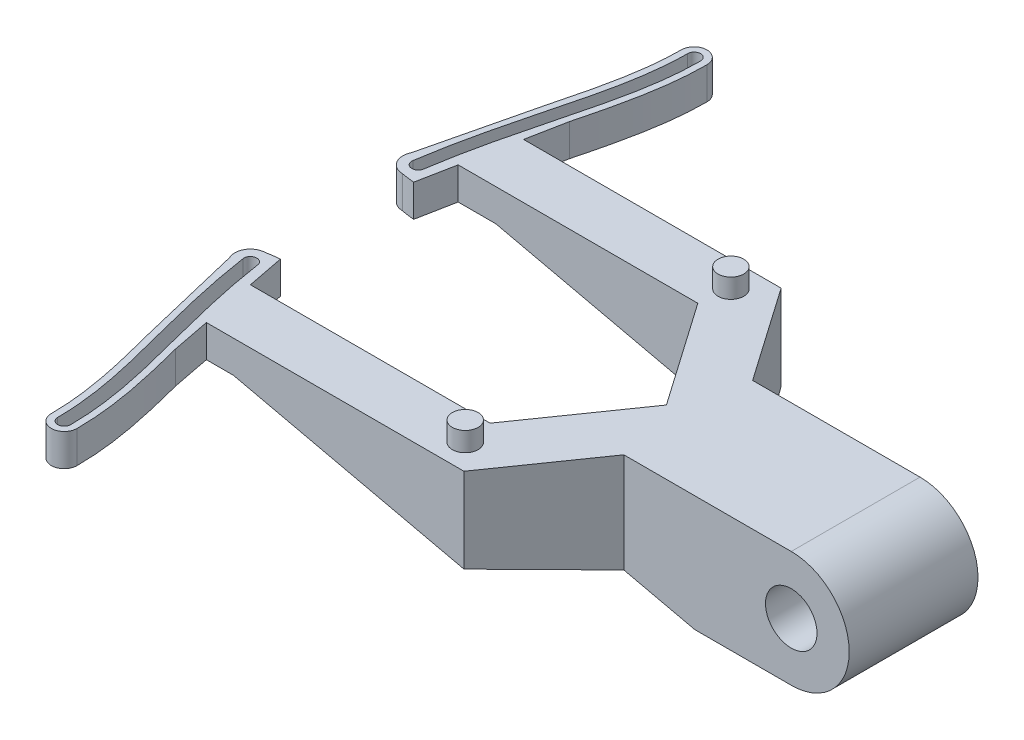
from build123d import *
from build123d.topology import SkipClean

# Parameters (mm, degrees)
SKETCH1_R               = 4
BOSS_EXTRUDE1_DEPTH     = 20
SKETCH2_R               = 2
BOSS_EXTRUDE2_DEPTH     = 3
CUT_EXTRUDE1_DEPTH      = 3
BOSS_EXTRUDE3_DEPTH     = 5
CUT_EXTRUDE2_DEPTH      = 101.233839294
CUT_EXTRUDE2_DEPTH_BACK = 101.233839294
BOSS_EXTRUDE4_START     = -2
BOSS_EXTRUDE4_DEPTH     = 2
CUT_EXTRUDE3_DEPTH      = 87.641828375
CUT_EXTRUDE3_DEPTH_BACK = 87.641828375
BOSS_EXTRUDE5_START     = 30
SKETCH8_R               = 4
BOSS_EXTRUDE5_DEPTH     = 30
CUT_EXTRUDE4_DEPTH      = 95.330150438
CUT_EXTRUDE4_DEPTH_BACK = 95.330150438


with BuildPart() as part:
    # Sketch1 → Boss-Extrude1 (new body)
    with BuildSketch(Plane.XY):
        with BuildLine():
            Line((0, 9), (-90, 9))
            Line((-90, 9), (-90, -9))
            Line((-90, -9), (0, -9))
            ThreePointArc((0, -9), (9, 0), (0, 9))
        make_face()
        Circle(SKETCH1_R, mode=Mode.SUBTRACT)
    extrude(amount=BOSS_EXTRUDE1_DEPTH)

    # Sketch2 → Boss-Extrude2 (add)
    with BuildSketch(Plane(origin=(0, 9, 0), x_dir=(1, 0, 0), z_dir=(0, 1, 0))):
        with Locations((-40, -10)):
            Circle(SKETCH2_R)
    extrude(amount=BOSS_EXTRUDE2_DEPTH)

    # Sketch3 → Cut-Extrude1 (cut)
    with BuildSketch(Plane(origin=(0, 9, 0), x_dir=(1, 0, 0), z_dir=(0, 1, 0))):
        with BuildLine():
            ThreePointArc((-79.971123065, -2.265451037), (-81.109001692, -1.425669976), (-81.948782753, -2.563548603))
            add(Edge.make_bspline(
                [(-75, -38.284271372), (-75.000000372, -35.299991519), (-75.743878784, -29.368041064), (-77.978217194, -20.541251955), (-80.298698299, -11.655347435), (-81.490438214, -5.604329939), (-81.948782753, -2.563548603)],
                knots=[0, 0, 0, 0, 0.171177105, 0.342354209, 0.513531314, 0.684708419, 0.684708419, 0.684708419, 0.684708419], degree=3))
            ThreePointArc((-75, -38.284271372), (-73.999999875, -39.284271247), (-73, -38.284271123))
            add(Edge.make_bspline(
                [(-73, -38.284271123), (-73.000000195, -36.723266395), (-73.196821218, -33.592705995), (-74.160174303, -27.46140767), (-76.050190168, -20.013503037), (-78.351483402, -11.19146534), (-79.520228797, -5.256805267), (-79.971123065, -2.265451037)],
                knots=[0, 0, 0, 0, 0.085588552, 0.171177105, 0.342354209, 0.513531314, 0.684708419, 0.684708419, 0.684708419, 0.684708419], degree=3))
        make_face()
    extrude(amount=-CUT_EXTRUDE1_DEPTH, mode=Mode.SUBTRACT)

    # Sketch4 → Boss-Extrude3 (add)
    with BuildSketch(Plane(origin=(0, 9, 0), x_dir=(1, 0, 0), z_dir=(0, 1, 0))):
        with BuildLine():
            Line((-90, -10), (-90, -0.41449982))
            Line((-90, -0.41449982), (-80.959952909, -0.41449982))
            ThreePointArc((-80.959952909, -0.41449982), (-79.655383082, -0.898552075), (-78.982293221, -2.116402253))
            add(Edge.make_bspline(
                [(-72, -38.284270998), (-72.000000199, -36.686938926), (-72.201891338, -33.476167151), (-73.182332484, -27.246191739), (-75.086106556, -19.748762966), (-77.377895983, -10.95977161), (-78.535124088, -5.083042932), (-78.982293221, -2.116402253)],
                knots=[0, 0, 0, 0, 0.085588552, 0.171177105, 0.342354209, 0.513531314, 0.684708419, 0.684708419, 0.684708419, 0.684708419], degree=3))
            ThreePointArc((-72, -38.284270998), (-73.99999975, -40.284271247), (-76, -38.284271497))
            add(Edge.make_bspline(
                [(-76, -38.284271497), (-76.000000181, -36.832248759), (-76.181610857, -33.942322546), (-77.093699759, -28.107055454), (-78.942441004, -20.807723253), (-80.653811295, -14.254625868), (-81.461843141, -10.616938278), (-81.594497194, -10)],
                knots=[0, 0, 0, 0, 0.085588552, 0.171177105, 0.342354209, 0.513531314, 0.548394238, 0.548394238, 0.548394238, 0.548394238], degree=3))
            Line((-81.594497194, -10), (-90, -10))
        make_face()
        with BuildLine():
            ThreePointArc((-75, -38.284271372), (-73.999999875, -39.284271247), (-73, -38.284271123))
            add(Edge.make_bspline(
                [(-73, -38.284271123), (-73.000000195, -36.723266395), (-73.196821218, -33.592705995), (-74.160174303, -27.46140767), (-76.050190168, -20.013503037), (-78.351483402, -11.19146534), (-79.520228797, -5.256805267), (-79.971123065, -2.265451037)],
                knots=[0, 0, 0, 0, 0.085588552, 0.171177105, 0.342354209, 0.513531314, 0.684708419, 0.684708419, 0.684708419, 0.684708419], degree=3))
            ThreePointArc((-79.971123065, -2.265451037), (-81.109001692, -1.425669976), (-81.948782753, -2.563548603))
            add(Edge.make_bspline(
                [(-81.948782753, -2.563548603), (-81.490438214, -5.604329939), (-80.298698299, -11.655347435), (-77.978217194, -20.541251955), (-75.743878784, -29.368041064), (-75.000000372, -35.299991519), (-75, -38.284271372)],
                knots=[0, 0, 0, 0, 0.171177105, 0.342354209, 0.513531314, 0.684708419, 0.684708419, 0.684708419, 0.684708419], degree=3))
        make_face(mode=Mode.SUBTRACT)
    extrude(amount=-BOSS_EXTRUDE3_DEPTH)

    # Sketch5 → Cut-Extrude2 (cut, two sides: drawn at the far end of the back side and taken through both)
    with BuildSketch(Plane(origin=(0, 9, 0), x_dir=(1, 0, 0), z_dir=(0, 1, 0)).offset(-CUT_EXTRUDE2_DEPTH_BACK)):
        with BuildLine():
            Line((-79.162032771, -19.999999885), (-83.13188577, -3.470019027))
            ThreePointArc((-83.13188577, -3.470019027), (-83.017493149, -1.150402786), (-81, 0))
            Line((-81, 0), (-90, 0))
            Line((-90, 0), (-90, -20))
            Line((-90, -20), (-79.162032771, -19.999999885))
        make_face()
    extrude(amount=CUT_EXTRUDE2_DEPTH + CUT_EXTRUDE2_DEPTH_BACK, mode=Mode.SUBTRACT)

    # Sketch6 → Boss-Extrude4 (add)
    with BuildSketch(Plane.XZ.offset(-4).offset(BOSS_EXTRUDE4_START)):
        with BuildLine():
            Line((-76.064161018, 20), (-78.129327832, 20))
            Line((-78.129327832, 20), (-79.162032327, 19.999999771))
            add(Edge.make_bspline(
                [(-76, 38.284271497), (-76.000000181, 36.832248759), (-76.181610857, 33.942322546), (-77.093699759, 28.107055454), (-78.268200121, 23.469809255), (-79.0949235, 20.260458438), (-79.162032327, 19.999999771)],
                knots=[0.190934795, 0.190934795, 0.190934795, 0.190934795, 0.276523348, 0.3621119, 0.533289005, 0.548394238, 0.548394238, 0.548394238, 0.548394238], degree=3))
            ThreePointArc((-76, 38.284271497), (-73.99999975, 40.284271247), (-72, 38.284270998))
            add(Edge.make_bspline(
                [(-75.031610496, 20.00000001), (-74.287622469, 22.893815084), (-73.170396852, 27.32203382), (-72.201891338, 33.476167151), (-72.000000199, 36.686938926), (-72, 38.284270998)],
                knots=[0, 0, 0, 0, 0.167009375, 0.252597927, 0.338186479, 0.338186479, 0.338186479, 0.338186479], degree=3))
            Line((-75.031610496, 20.00000001), (-76.064161018, 20))
        make_face()
    extrude(amount=BOSS_EXTRUDE4_DEPTH)

    # Sketch7 → Cut-Extrude3 (cut, two sides: drawn at the far end of the back side and taken through both)
    with BuildSketch(Plane.XY.offset(20).offset(-CUT_EXTRUDE3_DEPTH_BACK)):
        Polygon((-72, -21), (-15, -9), (-72, 4), (-92, 4), (-92, -21), align=None)
    extrude(amount=CUT_EXTRUDE3_DEPTH + CUT_EXTRUDE3_DEPTH_BACK, mode=Mode.SUBTRACT)

    # Sketch8 → Boss-Extrude5 (add)
    with SkipClean():  # the faces are left unmerged after this step: merging them gives an invalid solid
        with BuildSketch(Plane(origin=(0, 0, 0), x_dir=(-1, 0, 0), z_dir=(0, 0, -1)).offset(BOSS_EXTRUDE5_START)):
            with BuildLine():
                Line((15, -9), (72, 4))
                Line((72, 4), (81, 4))
                Line((81, 4), (81, 9))
                Line((81, 9), (0, 9))
                ThreePointArc((0, 9), (-9, 0), (0, -9))
                Line((0, -9), (15, -9))
            make_face()
            Circle(SKETCH8_R, mode=Mode.SUBTRACT)
        extrude(amount=-BOSS_EXTRUDE5_DEPTH)

    # Sketch9 → Cut-Extrude4 (cut, two sides: drawn at the far end of the back side and taken through both)
    with BuildSketch(Plane(origin=(0, 9, 0), x_dir=(1, 0, 0), z_dir=(0, 1, 0)).offset(-CUT_EXTRUDE4_DEPTH_BACK)):
        with BuildLine():
            Line((9, 0.626236109), (-26, 0.626236109))
            Line((-26, 0.626236109), (-36.200880428, -14.00000001))
            Line((-36.200880428, -14.00000001), (-76.200880428, -14.00000001))
            Line((-76.200880428, -14.00000001), (-75.031610496, -20.00000001))
            Line((-75.031610496, -20.00000001), (16, -20.00000001))
            Line((16, -20.00000001), (16, 10.626236109))
            Line((16, 10.626236109), (16, 30))
            Line((16, 30), (-81, 30))
            Line((-81, 30), (-81, 0))
            ThreePointArc((-81, 0), (-79.99562938, 0.16672565), (-78.983962224, 0.281125602))
            Line((-78.983962224, 0.281125602), (-77.857346165, -5.50000001))
            Line((-77.857346165, -5.50000001), (-40.635759862, -5.50000001))
            Line((-40.635759862, -5.50000001), (-29.388723709, 10.626236109))
            Line((-29.388723709, 10.626236109), (9, 10.626236109))
            Line((9, 10.626236109), (9, 0.626236109))
        make_face()
    extrude(amount=CUT_EXTRUDE4_DEPTH + CUT_EXTRUDE4_DEPTH_BACK, mode=Mode.SUBTRACT)

    # Mirror1: part across plane


with BuildPart() as part_1:
    add(part.part)
    add(part.part.mirror(Plane(origin=(9, -9, -10.626236109), x_dir=(1, 0, 0), z_dir=(0, 0, 1))))


solid = part_1.part
